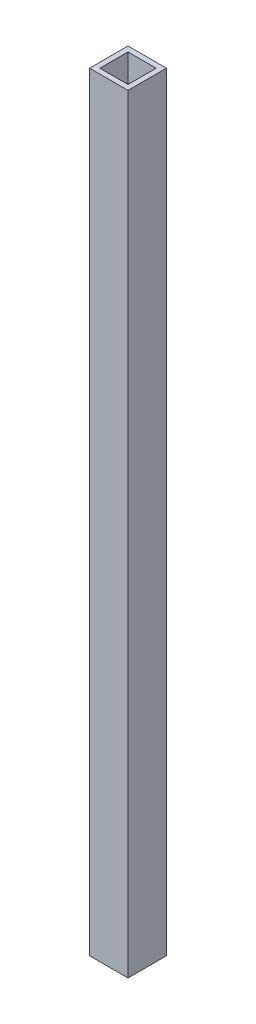
from build123d import *

# Parameters (mm, degrees)
SKETCH1_W           = 15
SKETCH1_H           = 15
SKETCH1_W_2         = 11
SKETCH1_H_2         = 11
BOSS_EXTRUDE1_DEPTH = 300


with BuildPart() as part:
    # Sketch1 → Boss-Extrude1 (new body)
    with BuildSketch(Plane(origin=(0, 0, 0), x_dir=(1, 0, 0), z_dir=(0, 1, 0))):
        with Locations((7.5, 7.5)):
            Rectangle(SKETCH1_W, SKETCH1_H)
        with Locations((7.5, 7.5)):
            Rectangle(SKETCH1_W_2, SKETCH1_H_2, mode=Mode.SUBTRACT)
    extrude(amount=BOSS_EXTRUDE1_DEPTH)


solid = part.part
